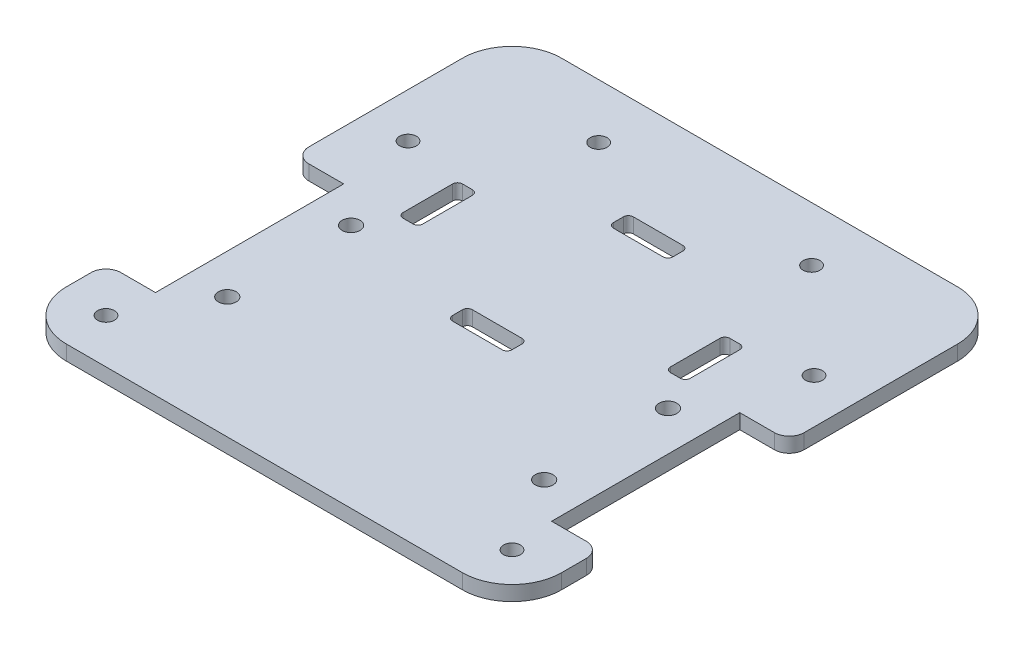
from build123d import *

# Parameters (mm, degrees)
SKETCH1_W           = 100
SKETCH1_H           = 100
BOSS_EXTRUDE1_DEPTH = 3
SKETCH4_R           = 1.7
CUT_EXTRUDE3_DEPTH  = 3
SKETCH2_W           = 10
SKETCH2_H           = 38
CUT_EXTRUDE4_DEPTH  = 3
SKETCH5_R           = 1.8
SKETCH5_R_2         = 1.7
SKETCH5_W           = 12
SKETCH5_H           = 4
SKETCH5_W_2         = 4
SKETCH5_H_2         = 12
CUT_EXTRUDE5_DEPTH  = 3
FILLET1_R           = 10
FILLET2_R           = 3
FILLET3_R           = 10
FILLET4_R           = 3
FILLET5_R           = 3
FILLET6_R           = 1


with BuildPart() as part:
    # Sketch1 → Boss-Extrude1 (new body)
    with BuildSketch(Plane(origin=(0, 0, 0), x_dir=(1, 0, 0), z_dir=(0, 1, 0))):
        Rectangle(SKETCH1_W, SKETCH1_H)
    extrude(amount=BOSS_EXTRUDE1_DEPTH)

    # Sketch4 → Cut-Extrude3 (cut)
    with BuildSketch(Plane(origin=(0, 3, 0), x_dir=(1, 0, 0), z_dir=(0, 1, 0))):
        with Locations(Location((-41, 20, 0), (0, 0, 270))):
            Circle(SKETCH4_R)
        with Locations(Location((-41, -41, 0), (0, 0, 270))):
            Circle(SKETCH4_R)
        with Locations(Location((41, -41, 0), (0, 0, 270))):
            Circle(SKETCH4_R)
        with Locations(Location((41, 20, 0), (0, 0, 270))):
            Circle(SKETCH4_R)
    extrude(amount=-CUT_EXTRUDE3_DEPTH, mode=Mode.SUBTRACT)

    # Sketch2 → Cut-Extrude4 (cut)
    with BuildSketch(Plane(origin=(0, 3, 0), x_dir=(1, 0, 0), z_dir=(0, 1, 0))):
        with Locations((-45, -13)):
            Rectangle(SKETCH2_W, SKETCH2_H)
    cut_extrude4 = extrude(amount=-CUT_EXTRUDE4_DEPTH, mode=Mode.SUBTRACT)

    # Mirror2: Cut-Extrude4 across plane
    add(cut_extrude4.mirror(Plane(origin=(0, 0, 0), x_dir=(0, 0, 1), z_dir=(1, 0, 0))), mode=Mode.SUBTRACT)

    # Sketch5 → Cut-Extrude5 (cut)
    with BuildSketch(Plane(origin=(0, 3, 0), x_dir=(1, 0, 0), z_dir=(0, 1, 0))):
        with Locations(Location((-32, -0.5, 0), (0, 0, 270))):
            Circle(SKETCH5_R)
        with Locations(Location((-32, -25.5, 0), (0, 0, 270))):
            Circle(SKETCH5_R)
        with Locations(Location((32, -25.5, 0), (0, 0, 270))):
            Circle(SKETCH5_R)
        with Locations(Location((32, -0.5, 0), (0, 0, 270))):
            Circle(SKETCH5_R)
        with Locations(Location((-21.5, 39, 0), (0, 0, 270))):
            Circle(SKETCH5_R_2)
        with Locations(Location((21.5, 39, 0), (0, 0, 270))):
            Circle(SKETCH5_R_2)
        with Locations((0, -5)):
            Rectangle(SKETCH5_W, SKETCH5_H)
        with Locations((0, 27.5)):
            Rectangle(SKETCH5_W, SKETCH5_H)
        with Locations((-27, 12)):
            Rectangle(SKETCH5_W_2, SKETCH5_H_2)
        with Locations((27, 12)):
            Rectangle(SKETCH5_W_2, SKETCH5_H_2)
    extrude(amount=-CUT_EXTRUDE5_DEPTH, mode=Mode.SUBTRACT)

    # Fillet1
    fillet1_edges = [part.edges().sort_by_distance(p)[0] for p in [
        (-50, 1.5, 50),
        (50, 1.5, 50),
    ]]
    fillet(fillet1_edges, radius=FILLET1_R)

    # Fillet2
    fillet2_edges = [part.edges().sort_by_distance(p)[0] for p in [
        (50, 1.5, -6),
        (50, 1.5, 32),
    ]]
    fillet(fillet2_edges, radius=FILLET2_R)

    # Fillet3
    fillet3_edges = [part.edges().sort_by_distance(p)[0] for p in [
        (-50, 1.5, -50),
        (50, 1.5, -50),
    ]]
    fillet(fillet3_edges, radius=FILLET3_R)

    # Fillet4
    fillet4_edges = [part.edges().sort_by_distance(p)[0] for p in [
        (-50, 1.5, 32),
    ]]
    fillet(fillet4_edges, radius=FILLET4_R)

    # Fillet5
    fillet5_edges = [part.edges().sort_by_distance(p)[0] for p in [
        (-50, 1.5, -6),
    ]]
    fillet(fillet5_edges, radius=FILLET5_R)

    # Fillet6
    fillet6_edges = [part.edges().sort_by_distance(p)[0] for p in [
        (-29, 1.5, -18),
        (-29, 1.5, -6),
        (-25, 1.5, -6),
        (-25, 1.5, -18),
        (25, 1.5, -18),
        (25, 1.5, -6),
        (29, 1.5, -6),
        (29, 1.5, -18),
        (-6, 1.5, 3),
        (-6, 1.5, 7),
        (6, 1.5, 7),
        (6, 1.5, 3),
        (-6, 1.5, -29.5),
        (-6, 1.5, -25.5),
        (6, 1.5, -25.5),
        (6, 1.5, -29.5),
    ]]
    fillet(fillet6_edges, radius=FILLET6_R)


solid = part.part
